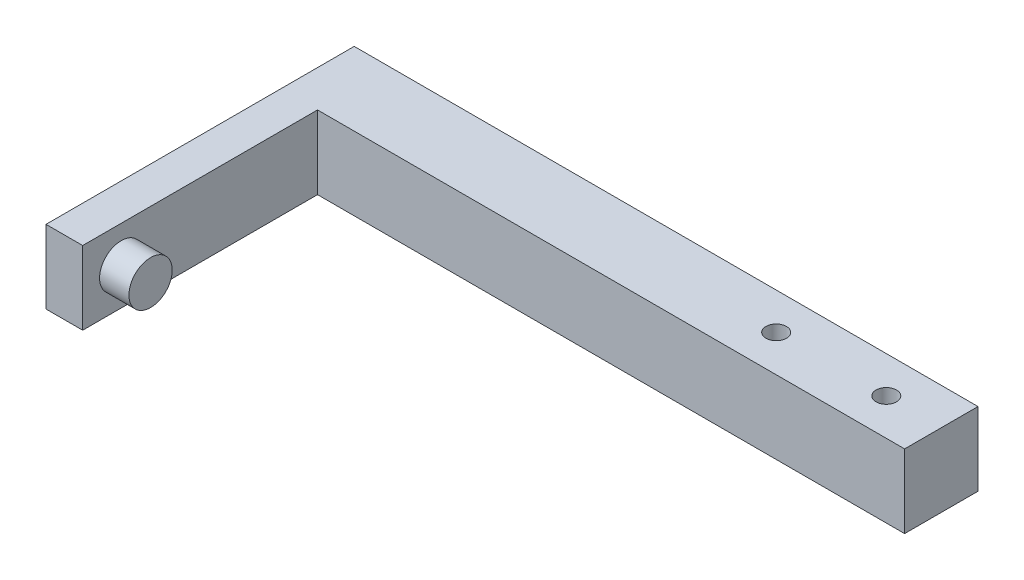
from build123d import *

# Parameters (mm, degrees)
SKETCH1_W           = 85
SKETCH1_H           = 10
BOSS_EXTRUDE1_DEPTH = 10
SKETCH2_R           = 1.4
CUT_EXTRUDE1_DEPTH  = 10
SKETCH3_W           = 5
SKETCH3_H           = 10
BOSS_EXTRUDE2_DEPTH = 32
SKETCH4_R           = 2.95
BOSS_EXTRUDE3_DEPTH = 4


with BuildPart() as part:
    # Sketch1 → Boss-Extrude1 (new body)
    with BuildSketch(Plane(origin=(0, 0, 0), x_dir=(1, 0, 0), z_dir=(0, 1, 0))):
        Rectangle(SKETCH1_W, SKETCH1_H)
    extrude(amount=BOSS_EXTRUDE1_DEPTH)

    # Sketch2 → Cut-Extrude1 (cut)
    with BuildSketch(Plane(origin=(0, 10, 0), x_dir=(1, 0, 0), z_dir=(0, 1, 0))):
        with Locations(Location((35, 0, 0), (0, 0, 270))):
            Circle(SKETCH2_R)
        with Locations(Location((20, 0, 0), (0, 0, 270))):
            Circle(SKETCH2_R)
    extrude(amount=-CUT_EXTRUDE1_DEPTH, mode=Mode.SUBTRACT)

    # Sketch3 → Boss-Extrude2 (add)
    with BuildSketch(Plane.XY.offset(5)):
        with Locations((-40, 5)):
            Rectangle(SKETCH3_W, SKETCH3_H)
    extrude(amount=BOSS_EXTRUDE2_DEPTH)

    # Sketch4 → Boss-Extrude3 (add)
    with BuildSketch(Plane(origin=(-37.5, 0, 0), x_dir=(0, 0, -1), z_dir=(1, 0, 0))):
        with Locations(Location((-31.75, 5, 0), (0, 0, 180))):
            Circle(SKETCH4_R)
    extrude(amount=BOSS_EXTRUDE3_DEPTH)


solid = part.part
